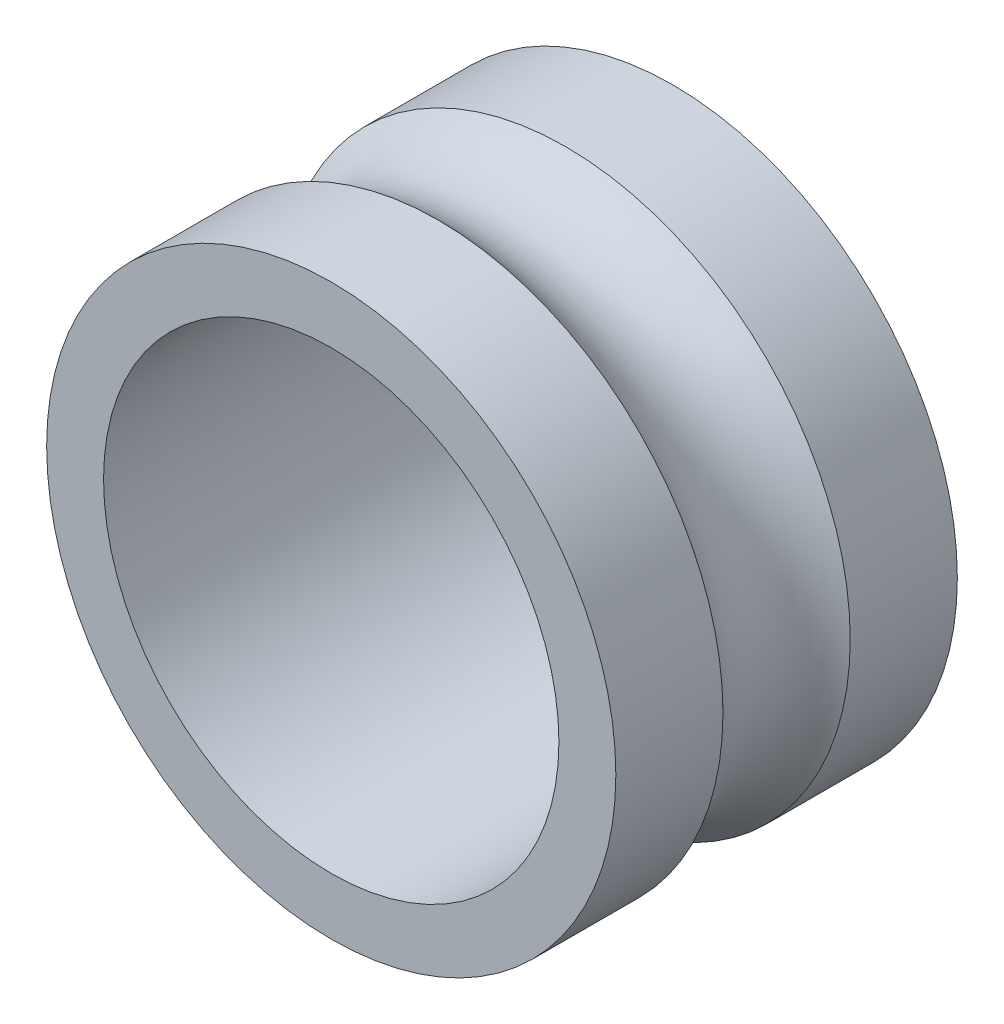
from build123d import *

# Parameters (mm, degrees)
ESQUISSE1_R        = 2.5
ESQUISSE1_R_2      = 2
BOSS_EXTRU_1_DEPTH = 1.5


with BuildPart() as part:
    # Esquisse1 → Boss.-Extru.1 (new, symmetric)
    with BuildSketch(Plane.XY):
        Circle(ESQUISSE1_R)
        Circle(ESQUISSE1_R_2, mode=Mode.SUBTRACT)
    extrude(amount=BOSS_EXTRU_1_DEPTH, both=True)

    # Esquisse2 → Enlèvement de matière-Révolution1 (revolve, cut)
    with BuildSketch(Plane(origin=(0, 0, 0), x_dir=(1, 0, 0), z_dir=(0, 1, 0)), mode=Mode.PRIVATE) as enl_vement_de_mati_re_r_volution1_sk:
        with BuildLine():
            Line((2.5, -0.559016994), (2.5, 0.559016994))
            ThreePointArc((2.5, 0.559016994), (2.25, 0), (2.5, -0.559016994))
        make_face()
    revolve(enl_vement_de_mati_re_r_volution1_sk.sketch.rotate(Axis((0, 0, -1.5), (0, 0, 1)), 180), axis=Axis((0, 0, -1.5), (0, 0, 1)), mode=Mode.SUBTRACT)


solid = part.part
